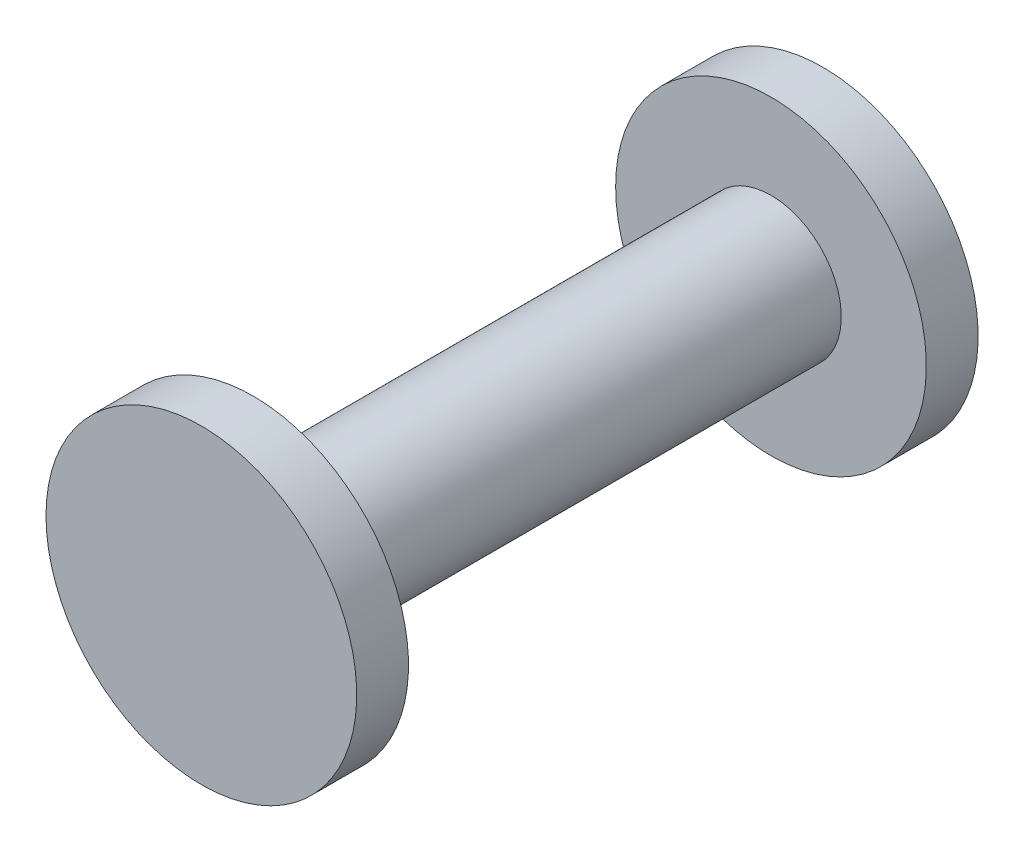
from build123d import *

# Parameters (mm, degrees)
ESBO_O1_2_R             = 48.65
EXTRUSI_N_1_DEPTH       = 490
CORTE_BARRIDO_1_PITCH   = 101.6
CORTE_BARRIDO_1_HEIGHT  = 914.4
CORTE_BARRIDO_1_RADIUS  = 48.65
CROQUIS_3_RX            = 47.863125
CROQUIS_3_RY            = 47.863125
CROQUIS3_R              = 13
SALIENTE_EXTRUIR1_DEPTH = 490
CROQUIS4_R              = 49
SALIENTE_EXTRUIR2_DEPTH = 10
CROQUIS5_R              = 13.571471
SALIENTE_EXTRUIR3_DEPTH = 120
CHAFL_N2_SIZE           = 2
CROQUIS19_W             = 451.947205317
CROQUIS19_H             = 279.188572138
CORTAR_EXTRUIR4_DEPTH   = 721
CROQUIS20_R             = 30
SALIENTE_EXTRUIR4_DEPTH = 10
SALIENTE_EXTRUIR5_START = -10
CROQUIS21_R             = 30
SALIENTE_EXTRUIR5_DEPTH = 10


with BuildPart() as part:
    # Esboço1<2> → Extrusión 1 (new body)
    with BuildSketch(Plane.XY):
        Circle(ESBO_O1_2_R)
    extrude(amount=EXTRUSI_N_1_DEPTH)

    # Corte Barrido 1: sweep along a helix
    with BuildLine() as corte_barrido_1_path:
        Helix(CORTE_BARRIDO_1_PITCH, CORTE_BARRIDO_1_HEIGHT, CORTE_BARRIDO_1_RADIUS, center=(0, 0, 0), direction=(0, 0, 1), lefthand=True)
    # Croquis 3 → Corte Barrido 1 (sweep, cut)
    with BuildSketch(Plane(origin=(0, 0, 0), x_dir=(1, 0, 0), z_dir=(0, 1, 0))):
        with Locations(Location((-48.65, 0), (0, 0, -180))):
            Ellipse(CROQUIS_3_RX, CROQUIS_3_RY)
    sweep(path=corte_barrido_1_path.line, is_frenet=True, mode=Mode.SUBTRACT)

    # Croquis3 → Saliente-Extruir1 (add)
    with BuildSketch(Plane(origin=(0, 0, 0), x_dir=(-1, 0, 0), z_dir=(0, 0, -1))):
        Circle(CROQUIS3_R)
    extrude(amount=-SALIENTE_EXTRUIR1_DEPTH)

    # Croquis4 → Saliente-Extruir2 (add)
    with BuildSketch(Plane(origin=(0, 0, 0), x_dir=(-1, 0, 0), z_dir=(0, 0, -1))):
        Circle(CROQUIS4_R)
    extrude(amount=SALIENTE_EXTRUIR2_DEPTH)

    # Croquis5 → Saliente-Extruir3 (add)
    with BuildSketch(Plane(origin=(0, 0, -10), x_dir=(-1, 0, 0), z_dir=(0, 0, -1))):
        Circle(CROQUIS5_R)
    extrude(amount=SALIENTE_EXTRUIR3_DEPTH)

    # Croquis11 → Revolución1 (revolve)
    with BuildSketch(Plane(origin=(0, 0, 0), x_dir=(0, 0, -1), z_dir=(1, 0, 0)), mode=Mode.PRIVATE) as revoluci_n1_sk:
        Polygon((-490, -13), (-490, 0), (-564, 0), (-564, -6), (-526, -6), (-526, -13), (-495, -13), align=None)
    revolve(revoluci_n1_sk.sketch.rotate(Axis((0, 0, 490), (0, 0, 1)), 270), axis=Axis((0, 0, 490), (0, 0, 1)))

    # Chaflán2
    chafl_n2_edges = [part.edges().sort_by_distance(p)[0] for p in [
        (6, 0, 564),
    ]]
    chamfer(chafl_n2_edges, length=CHAFL_N2_SIZE)

    # Croquis12 → Cortar-Revolución1 (revolve, cut)
    with BuildSketch(Plane(origin=(0, 0, 0), x_dir=(1, 0, 0), z_dir=(0, 1, 0))):
        Polygon((-13, -505), (-12, -505), (-12, -509.7), (-13, -509.7), (-15.609105151, -509.7), (-15.609105151, -505), align=None)
    revolve(axis=Axis((0, 0, 526), (0, 0, -1)), mode=Mode.SUBTRACT)

    # Croquis19 → Cortar-Extruir4 (cut)
    with BuildSketch(Plane(origin=(0, 0, -10), x_dir=(-1, 0, 0), z_dir=(0, 0, -1))):
        with Locations((-30.102891015, -20.278452223)):
            Rectangle(CROQUIS19_W, CROQUIS19_H)
    extrude(amount=-CORTAR_EXTRUIR4_DEPTH, mode=Mode.SUBTRACT)

    # Croquis20 → Saliente-Extruir4 (add)
    with BuildSketch(Plane(origin=(0, 0, -10), x_dir=(-1, 0, 0), z_dir=(0, 0, -1))):
        Circle(CROQUIS20_R)
    extrude(amount=SALIENTE_EXTRUIR4_DEPTH)

    # Croquis21 → Saliente-Extruir5 (add)
    with BuildSketch(Plane(origin=(0, 0, -130), x_dir=(-1, 0, 0), z_dir=(0, 0, -1)).offset(SALIENTE_EXTRUIR5_START)):
        Circle(CROQUIS21_R)
    extrude(amount=SALIENTE_EXTRUIR5_DEPTH)


solid = part.part
